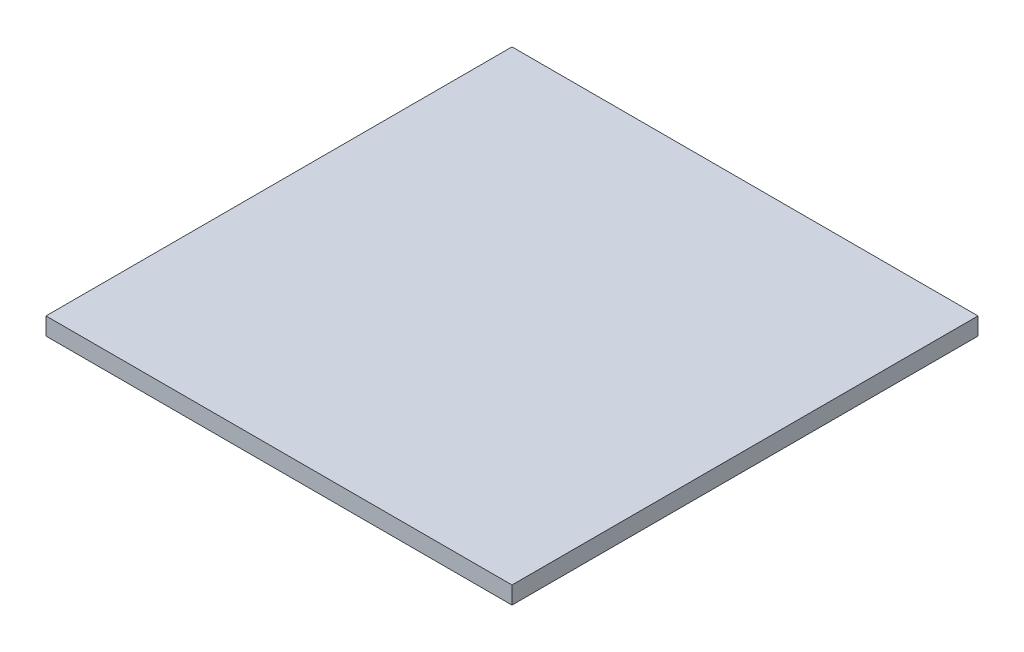
from build123d import *

# Parameters (mm, degrees)
SKETCH1_W           = 400
SKETCH1_H           = 400
BOSS_EXTRUDE1_DEPTH = 15


with BuildPart() as part:
    # Sketch1 → Boss-Extrude1 (new body)
    with BuildSketch(Plane(origin=(0, 0, 0), x_dir=(1, 0, 0), z_dir=(0, 1, 0))):
        Rectangle(SKETCH1_W, SKETCH1_H)
    extrude(amount=BOSS_EXTRUDE1_DEPTH)


solid = part.part
